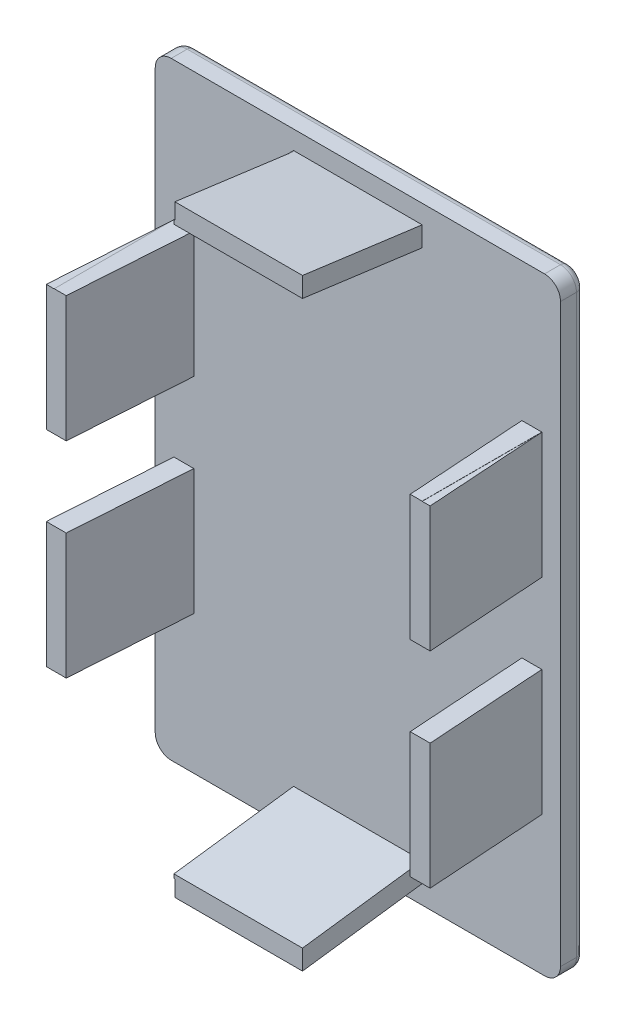
from build123d import *

# Parameters (mm, degrees)
CROQUIS1_W              = 50.8
CROQUIS1_H              = 76.2
SALIENTE_EXTRUIR1_DEPTH = 18
CROQUIS2_W              = 50.8
CROQUIS2_H              = 76.2
CROQUIS2_W_2            = 46.12
CROQUIS2_H_2            = 71.52
CROQUIS2_W_3            = 38.8
CROQUIS2_H_3            = 64.2
CORTAR_EXTRUIR1_DEPTH   = 15
CORTAR_EXTRUIR8_DEPTH   = 15
SALIENTE_EXTRUIR3_DEPTH = 41.5
CORTAR_EXTRUIR9_DEPTH   = 51.5
CORTAR_EXTRUIR10_DEPTH  = 51.5
SALIENTE_EXTRUIR4_DEPTH = 16
CORTAR_EXTRUIR11_DEPTH  = 16.5
REDONDEO3_R             = 2
REDONDEO4_R             = 1
CROQUIS15_W             = 48.12
CROQUIS15_H             = 10
CORTAR_EXTRUIR12_DEPTH  = 15
CROQUIS16_W             = 8
CROQUIS16_H             = 1.5
CORTAR_EXTRUIR13_DEPTH  = 2
CROQUIS17_R             = 3
CORTAR_EXTRUIR14_DEPTH  = 10


with BuildPart() as part:
    # Croquis1 → Saliente-Extruir1 (new body)
    with BuildSketch(Plane.XY):
        Rectangle(CROQUIS1_W, CROQUIS1_H)
    extrude(amount=SALIENTE_EXTRUIR1_DEPTH)

    # Croquis2 → Cortar-Extruir1 (cut)
    # profile 1 of 2: a face of its own
    with BuildSketch(Plane.XY.offset(18)):
        Rectangle(CROQUIS2_W, CROQUIS2_H)
        Rectangle(CROQUIS2_W_2, CROQUIS2_H_2, mode=Mode.SUBTRACT)
    # profile 2 of 2: a face of its own
    with BuildSketch(Plane.XY.offset(18)):
        Rectangle(CROQUIS2_W_3, CROQUIS2_H_3)
    extrude(amount=-CORTAR_EXTRUIR1_DEPTH, mode=Mode.SUBTRACT)

    # Croquis6 → Cortar-Extruir8 (cut)
    with BuildSketch(Plane.XY.offset(18)):
        Polygon((-23.06, 35.76), (-8.06, 35.76), (-8.06, 32.1), (-19.4, 32.1), (-19.4, 20.76), (-23.06, 20.76), align=None)
        Polygon((23.06, 35.76), (8.06, 35.76), (8.06, 32.1), (19.4, 32.1), (19.4, 20.76), (23.06, 20.76), align=None)
        Polygon((-23.06, -35.76), (-23.06, -20.76), (-19.4, -20.76), (-19.4, -32.1), (-8.06, -32.1), (-8.06, -35.76), align=None)
        Polygon((23.06, -35.76), (8.06, -35.76), (8.06, -32.1), (19.4, -32.1), (19.4, -20.76), (23.06, -20.76), align=None)
    extrude(amount=-CORTAR_EXTRUIR8_DEPTH, mode=Mode.SUBTRACT)

    # Croquis10 → Saliente-Extruir3 (add)
    with BuildSketch(Plane(origin=(0, -20.76, 0), x_dir=(-1, 0, 0), z_dir=(0, -1, 0))):
        Polygon((23.06, -18), (24.06, -18), (23.06, -3), align=None)
        Polygon((-23.06, -18), (-24.06, -18), (-23.06, -3), align=None)
    extrude(amount=-SALIENTE_EXTRUIR3_DEPTH)

    # Croquis11 → Cortar-Extruir9 (cut)
    with BuildSketch(Plane.XZ.offset(20.76)):
        Polygon((-19.4, 18), (-21.56, 18), (-20.56, 3), (-19.4, 3), align=None)
    extrude(amount=-CORTAR_EXTRUIR9_DEPTH, mode=Mode.SUBTRACT)

    # Croquis12 → Cortar-Extruir10 (cut)
    with BuildSketch(Plane.XZ.offset(20.76)):
        Polygon((19.4, 18), (19.4, 3), (20.56, 3), (21.56, 18), align=None)
    extrude(amount=-CORTAR_EXTRUIR10_DEPTH, mode=Mode.SUBTRACT)

    # Croquis13 → Saliente-Extruir4 (add)
    with BuildSketch(Plane(origin=(8.06, 0, 0), x_dir=(0, 0, -1), z_dir=(1, 0, 0))):
        Polygon((-18, -35.76), (-18, -37.76), (-3, -35.76), align=None)
        Polygon((-18, 35.76), (-18, 37.76), (-3, 35.76), align=None)
    extrude(amount=-SALIENTE_EXTRUIR4_DEPTH)

    # Croquis14 → Cortar-Extruir11 (cut)
    with BuildSketch(Plane(origin=(8.06, 0, 0), x_dir=(0, 0, -1), z_dir=(1, 0, 0))):
        Polygon((-3, -32.1), (-18, -32.1), (-18, -35.26), (-3, -33.26), align=None)
        Polygon((-18, 32.1), (-18, 35.26), (-3, 33.26), (-3, 32.1), align=None)
    extrude(amount=-CORTAR_EXTRUIR11_DEPTH, mode=Mode.SUBTRACT)

    # Redondeo3
    redondeo3_edges = [part.edges().sort_by_distance(p)[0] for p in [
        (-25.4, 38.1, 1.5),
        (25.4, 38.1, 1.5),
        (25.4, -38.1, 1.5),
        (-25.4, -38.1, 1.5),
    ]]
    fillet(redondeo3_edges, radius=REDONDEO3_R)

    # Redondeo4
    redondeo4_edges = [part.edges().sort_by_distance(p)[0] for p in [
        (0, 38.1, 0),
        (-25.4, 0, 0),
        (25.4, 0, 0),
        (0, -38.1, 0),
        (24.814213562, -37.514213562, 0),
        (-24.814213562, -37.514213562, 0),
        (-24.814213562, 37.514213562, 0),
        (24.814213562, 37.514213562, 0),
    ]]
    fillet(redondeo4_edges, radius=REDONDEO4_R)

    # Croquis15 → Cortar-Extruir12 (cut)
    with BuildSketch(Plane.XY.offset(18)):
        with Locations((0, -0.01)):
            Rectangle(CROQUIS15_W, CROQUIS15_H)
    extrude(amount=-CORTAR_EXTRUIR12_DEPTH, mode=Mode.SUBTRACT)

    # Croquis16 → Cortar-Extruir13 (cut)
    with BuildSketch(Plane.XZ.offset(38.1)):
        with Locations((0, 2.25)):
            Rectangle(CROQUIS16_W, CROQUIS16_H)
    extrude(amount=-CORTAR_EXTRUIR13_DEPTH, mode=Mode.SUBTRACT)

    # Croquis17 → Cortar-Extruir14 (cut)
    with BuildSketch(Plane.XY.offset(3)):
        with Locations((13.4, -23.1)):
            Circle(CROQUIS17_R)
    extrude(amount=-CORTAR_EXTRUIR14_DEPTH, mode=Mode.SUBTRACT)


solid = part.part
